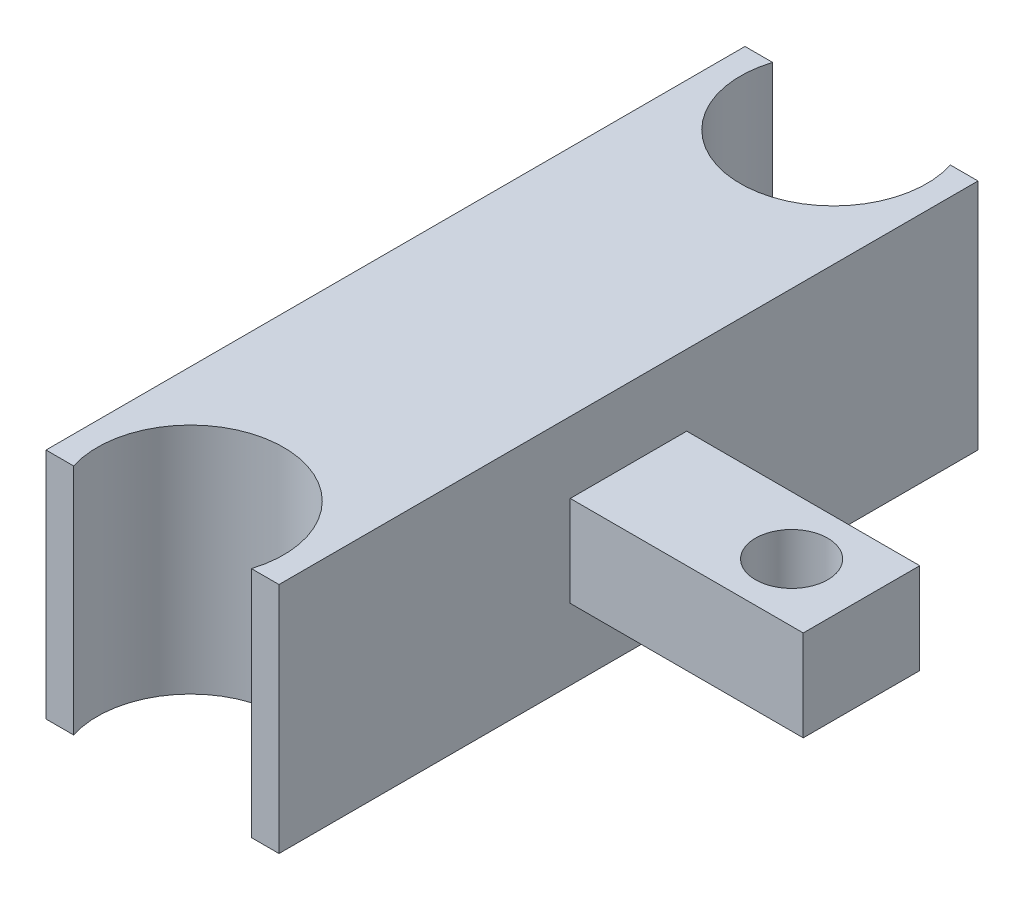
from build123d import *

# Parameters (mm, degrees)
SKETCH_1_W          = 10
SKETCH_1_H          = 5
SKETCH_1_R          = 1.55
EXTRUDE_1_DEPTH     = 3.9
SKETCH_2_W          = 30
SKETCH_2_H          = 10
EXTRUDE_2_DEPTH     = 10
SKETCH_3_R          = 4
CUT_EXTRUDE_1_DEPTH = 10


with BuildPart() as part:
    # 草图1 → 凸台-拉伸1 (new body)
    with BuildSketch(Plane(origin=(0, 0, 0), x_dir=(1, 0, 0), z_dir=(0, 1, 0))):
        with Locations((5, 2.5)):
            Rectangle(SKETCH_1_W, SKETCH_1_H)
        with Locations(Location((7, 2.5, 0), (0, 0, 270))):
            Circle(SKETCH_1_R, mode=Mode.SUBTRACT)
    extrude(amount=EXTRUDE_1_DEPTH)

    # 草图2 → 凸台-拉伸2 (add)
    with BuildSketch(Plane.ZY):
        with Locations((-2.5, 1.95)):
            Rectangle(SKETCH_2_W, SKETCH_2_H)
    extrude(amount=EXTRUDE_2_DEPTH)

    # 草图3 → 切除-拉伸1 (cut)
    with BuildSketch(Plane(origin=(0, 6.95, 0), x_dir=(1, 0, 0), z_dir=(0, 1, 0))):
        with Locations((-5, 16.3)):
            Circle(SKETCH_3_R)
        with Locations((-5, -11.3)):
            Circle(SKETCH_3_R)
    extrude(amount=-CUT_EXTRUDE_1_DEPTH, mode=Mode.SUBTRACT)


solid = part.part
